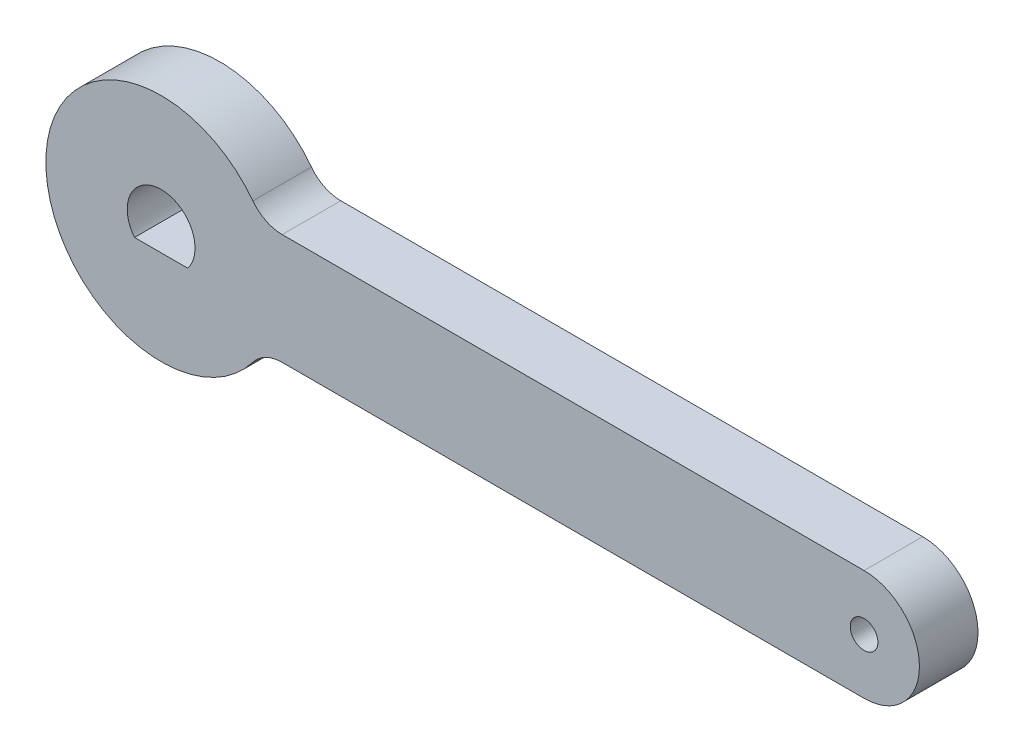
from build123d import *

# Parameters (mm, degrees)
BOSS_EXTRU_1_DEPTH      = 6.35
ESQUISSE4_R             = 12.5
BOSS_EXTRU_2_DEPTH      = 6.35
ENL_V_MAT_EXTRU_1_REACH = 85.387
ESQUISSE3_R             = 1.5
ENL_V_MAT_EXTRU_2_DEPTH = 6.35
CONG_1_R                = 4


with BuildPart() as part:
    # Esquisse1 → Boss.-Extru.1 (new body)
    with BuildSketch(Plane.XY):
        with BuildLine():
            Line((0, 6), (76.2, 6))
            ThreePointArc((76.2, 6), (82.2, 0), (76.2, -6))
            Line((76.2, -6), (0, -6))
            ThreePointArc((0, -6), (-6, 0), (0, 6))
        make_face()
    extrude(amount=BOSS_EXTRU_1_DEPTH)

    # Esquisse4 → Boss.-Extru.2 (add)
    with BuildSketch(Plane.XY.offset(6.35)):
        Circle(ESQUISSE4_R)
    extrude(amount=-BOSS_EXTRU_2_DEPTH)

    # Esquisse2 → Enlèv. mat.-Extru.1 (cut, up to next)
    with BuildSketch(Plane.XY.offset(6.35), mode=Mode.PRIVATE) as enl_v_mat_extru_1_sk1:
        with BuildLine():
            Line((-2.886173938, -2.275), (2.886173938, -2.275))
            ThreePointArc((2.886173938, -2.275), (0, 3.675), (-2.886173938, -2.275))
        make_face()
    enl_v_mat_extru_1_tool1 = extrude(enl_v_mat_extru_1_sk1.sketch, amount=-ENL_V_MAT_EXTRU_1_REACH, mode=Mode.PRIVATE) & part.part
    add(enl_v_mat_extru_1_tool1.solids().sort_by_distance((0, 0.435587, 6.35))[0], mode=Mode.SUBTRACT)

    # Esquisse3 → Enlèv. mat.-Extru.2 (cut)
    with BuildSketch(Plane.XY.offset(6.35)):
        with Locations((76.2, 0)):
            Circle(ESQUISSE3_R)
    extrude(amount=-ENL_V_MAT_EXTRU_2_DEPTH, mode=Mode.SUBTRACT)

    # Congé1
    cong_1_edges = [part.edges().sort_by_distance(p)[0] for p in [
        (10.9658561, -6, 3.175),
        (10.9658561, 6, 3.175),
    ]]
    fillet(cong_1_edges, radius=CONG_1_R)


solid = part.part
